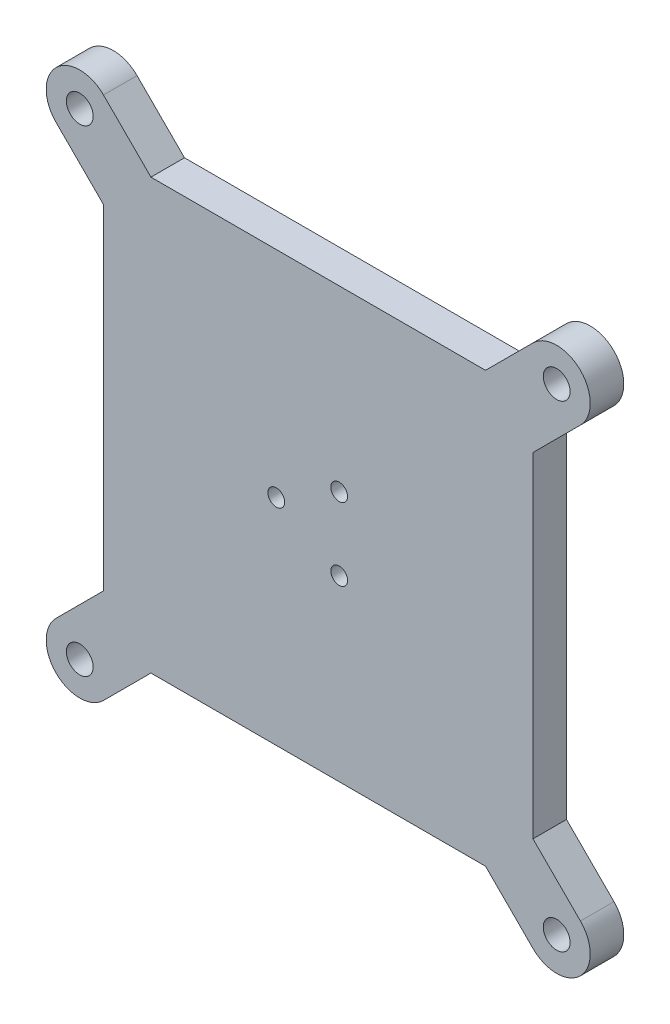
from build123d import *

# Parameters (mm, degrees)
SKETCH1_R           = 1.25
SKETCH1_R_2         = 2
BOSS_EXTRUDE1_DEPTH = 5
SKETCH2_R           = 2.25
CUT_EXTRUDE1_DEPTH  = 1.5


with BuildPart() as part:
    # Sketch1 → Boss-Extrude1 (new body)
    with BuildSketch(Plane.XY):
        with BuildLine():
            Line((-32, -24.928932188), (-39.071067812, -32))
            ThreePointArc((-39.071067812, -32), (-39.071067812, -39.071067812), (-32, -39.071067812))
            Line((-32, -39.071067812), (-24.928932188, -32))
            Line((-24.928932188, -32), (24.928932188, -32))
            Line((24.928932188, -32), (32, -39.071067812))
            ThreePointArc((32, -39.071067812), (39.071067812, -39.071067812), (39.071067812, -32))
            Line((39.071067812, -32), (32, -24.928932188))
            Line((32, -24.928932188), (32, 24.928932188))
            Line((32, 24.928932188), (39.071067812, 32))
            ThreePointArc((39.071067812, 32), (39.071067812, 39.071067812), (32, 39.071067812))
            Line((32, 39.071067812), (24.928932188, 32))
            Line((24.928932188, 32), (-24.928932188, 32))
            Line((-24.928932188, 32), (-32, 39.071067812))
            ThreePointArc((-32, 39.071067812), (-39.071067812, 39.071067812), (-39.071067812, 32))
            Line((-39.071067812, 32), (-32, 24.928932188))
            Line((-32, 24.928932188), (-32, -24.928932188))
        make_face()
        with Locations((3.125, -5.412658774)):
            Circle(SKETCH1_R, mode=Mode.SUBTRACT)
        with Locations((-6.25, 0)):
            Circle(SKETCH1_R, mode=Mode.SUBTRACT)
        with Locations((3.125, 5.412658774)):
            Circle(SKETCH1_R, mode=Mode.SUBTRACT)
        with Locations((-35.535533906, -35.535533906)):
            Circle(SKETCH1_R_2, mode=Mode.SUBTRACT)
        with Locations((35.535533906, -35.535533906)):
            Circle(SKETCH1_R_2, mode=Mode.SUBTRACT)
        with Locations((35.535533906, 35.535533906)):
            Circle(SKETCH1_R_2, mode=Mode.SUBTRACT)
        with Locations((-35.535533906, 35.535533906)):
            Circle(SKETCH1_R_2, mode=Mode.SUBTRACT)
    extrude(amount=BOSS_EXTRUDE1_DEPTH)

    # Sketch2 → Cut-Extrude1 (cut)
    with BuildSketch(Plane(origin=(0, 0, 0), x_dir=(-1, 0, 0), z_dir=(0, 0, -1))):
        with Locations((-3.125, 5.412658774)):
            Circle(SKETCH2_R)
        with Locations((-3.125, -5.412658774)):
            Circle(SKETCH2_R)
        with Locations((6.25, 0)):
            Circle(SKETCH2_R)
    extrude(amount=-CUT_EXTRUDE1_DEPTH, mode=Mode.SUBTRACT)


solid = part.part
